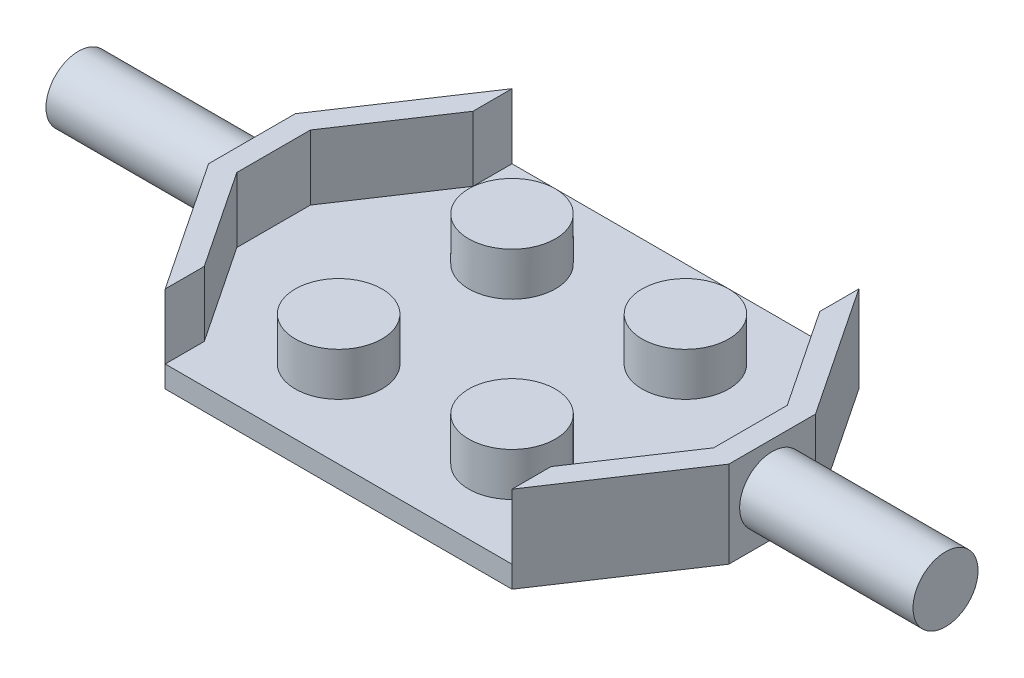
from build123d import *

# Parameters (mm, degrees)
BOSS_EXTRUDE1_DEPTH = 1
SKETCH4_R           = 2
BOSS_EXTRUDE2_DEPTH = 2
BOSS_EXTRUDE3_DEPTH = 3
SKETCH6_R           = 1.5
BOSS_EXTRUDE4_DEPTH = 8


with BuildPart() as part:
    # Sketch3 → Boss-Extrude1 (new body)
    with BuildSketch(Plane(origin=(0, 0, 0), x_dir=(1, 0, 0), z_dir=(0, 1, 0))):
        Polygon((-12, -2), (-12, 2), (-8, 8), (0, 8), (0, -8), (-8, -8), align=None)
    boss_extrude1 = extrude(amount=BOSS_EXTRUDE1_DEPTH)

    # Sketch4 → Boss-Extrude2 (add)
    with BuildSketch(Plane(origin=(0, 1, 0), x_dir=(1, 0, 0), z_dir=(0, 1, 0))):
        with Locations((-4, 4)):
            Circle(SKETCH4_R)
        with Locations((-4, -4)):
            Circle(SKETCH4_R)
    boss_extrude2 = extrude(amount=BOSS_EXTRUDE2_DEPTH)

    # Sketch5 → Boss-Extrude3 (add)
    with BuildSketch(Plane(origin=(0, 1, 0), x_dir=(1, 0, 0), z_dir=(0, 1, 0))):
        Polygon((-12, -2), (-8, -8), (-8, -6.197224362), (-11, -1.697224362), (-11, 1.697224362), (-8, 6.197224362), (-8, 8), (-12, 2), align=None)
    boss_extrude3 = extrude(amount=BOSS_EXTRUDE3_DEPTH)

    # Sketch6 → Boss-Extrude4 (add)
    with BuildSketch(Plane.ZY.offset(12)):
        with Locations((0, 2)):
            Circle(SKETCH6_R)
    boss_extrude4 = extrude(amount=BOSS_EXTRUDE4_DEPTH)

    # Mirror1: Boss-Extrude1, Boss-Extrude2, Boss-Extrude3, Boss-Extrude4 across plane
    add(boss_extrude1.mirror(Plane(origin=(0, 0, 0), x_dir=(0, 0, 1), z_dir=(1, 0, 0))))
    add(boss_extrude2.mirror(Plane(origin=(0, 0, 0), x_dir=(0, 0, 1), z_dir=(1, 0, 0))))
    add(boss_extrude3.mirror(Plane(origin=(0, 0, 0), x_dir=(0, 0, 1), z_dir=(1, 0, 0))))
    add(boss_extrude4.mirror(Plane(origin=(0, 0, 0), x_dir=(0, 0, 1), z_dir=(1, 0, 0))))


solid = part.part
